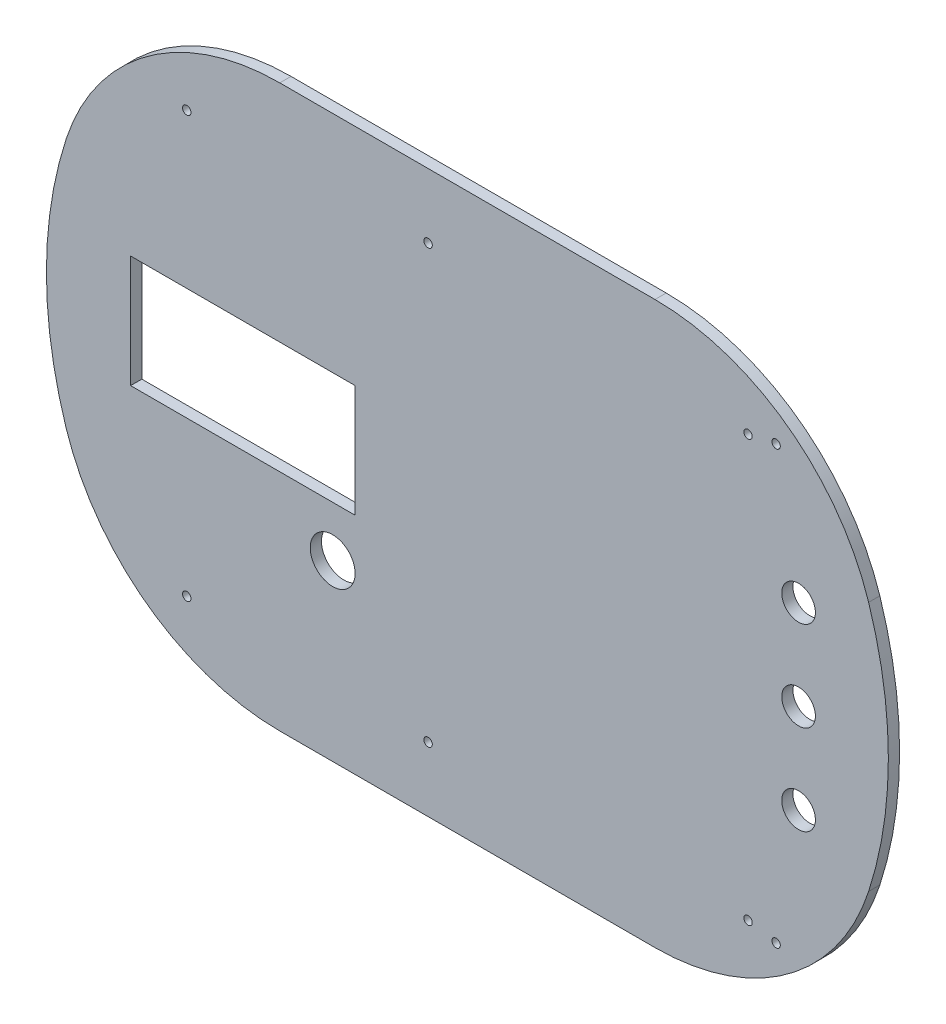
from build123d import *

# Parameters (mm, degrees)
SKETCH1_W           = 110
SKETCH1_H           = 100
BOSS_EXTRUDE1_DEPTH = 2
FILLET2_R           = 40
SKETCH6_R           = 4
SKETCH6_W           = 40
SKETCH6_H           = 20
CUT_EXTRUDE4_DEPTH  = 3
SKETCH7_R           = 0.75
SKETCH7_R_2         = 3
CUT_EXTRUDE7_DEPTH  = 10
SKETCH8_R           = 0.75
CUT_EXTRUDE8_DEPTH  = 10


with BuildPart() as part:
    # Sketch1 → Boss-Extrude1 (new body)
    with BuildSketch(Plane.XY):
        with BuildLine():
            Line((-55, 50), (-55, -50))
            ThreePointArc((-55, -50), (-75, 0), (-55, 50))
        make_face()
        Rectangle(SKETCH1_W, SKETCH1_H)
        with BuildLine():
            ThreePointArc((55, 50), (75, 0), (55, -50))
            Line((55, -50), (55, 50))
        make_face()
    extrude(amount=BOSS_EXTRUDE1_DEPTH)

    # Fillet2
    fillet2_edges = [part.edges().sort_by_distance(p)[0] for p in [
        (-55, 50, 1),
        (55, 50, 1),
        (55, -50, 1),
        (-55, -50, 1),
    ]]
    fillet(fillet2_edges, radius=FILLET2_R)

    # Sketch6 → Cut-Extrude4 (cut)
    with BuildSketch(Plane.XY.offset(2)):
        with Locations((-24, -19)):
            Circle(SKETCH6_R)
        with Locations((-40, 0)):
            Rectangle(SKETCH6_W, SKETCH6_H)
    extrude(amount=-CUT_EXTRUDE4_DEPTH, mode=Mode.SUBTRACT)

    # Sketch7 → Cut-Extrude7 (cut)
    with BuildSketch(Plane.XY.offset(2)):
        with Locations((-7, 38.5)):
            Circle(SKETCH7_R)
        with Locations((55, 38.5)):
            Circle(SKETCH7_R)
        with Locations((55, -38.5)):
            Circle(SKETCH7_R)
        with Locations((-7, -38.5)):
            Circle(SKETCH7_R)
        with Locations((59, 16)):
            Circle(SKETCH7_R_2)
        with Locations((59, -16)):
            Circle(SKETCH7_R_2)
        with Locations((59, 0)):
            Circle(SKETCH7_R_2)
    extrude(amount=-CUT_EXTRUDE7_DEPTH, mode=Mode.SUBTRACT)

    # Sketch8 → Cut-Extrude8 (cut)
    with BuildSketch(Plane.XY.offset(2)):
        with Locations((-50, 37.5)):
            Circle(SKETCH8_R)
        with Locations((50, 37.5)):
            Circle(SKETCH8_R)
        with Locations((50, -37.5)):
            Circle(SKETCH8_R)
        with Locations((-50, -37.5)):
            Circle(SKETCH8_R)
    extrude(amount=-CUT_EXTRUDE8_DEPTH, mode=Mode.SUBTRACT)


solid = part.part
